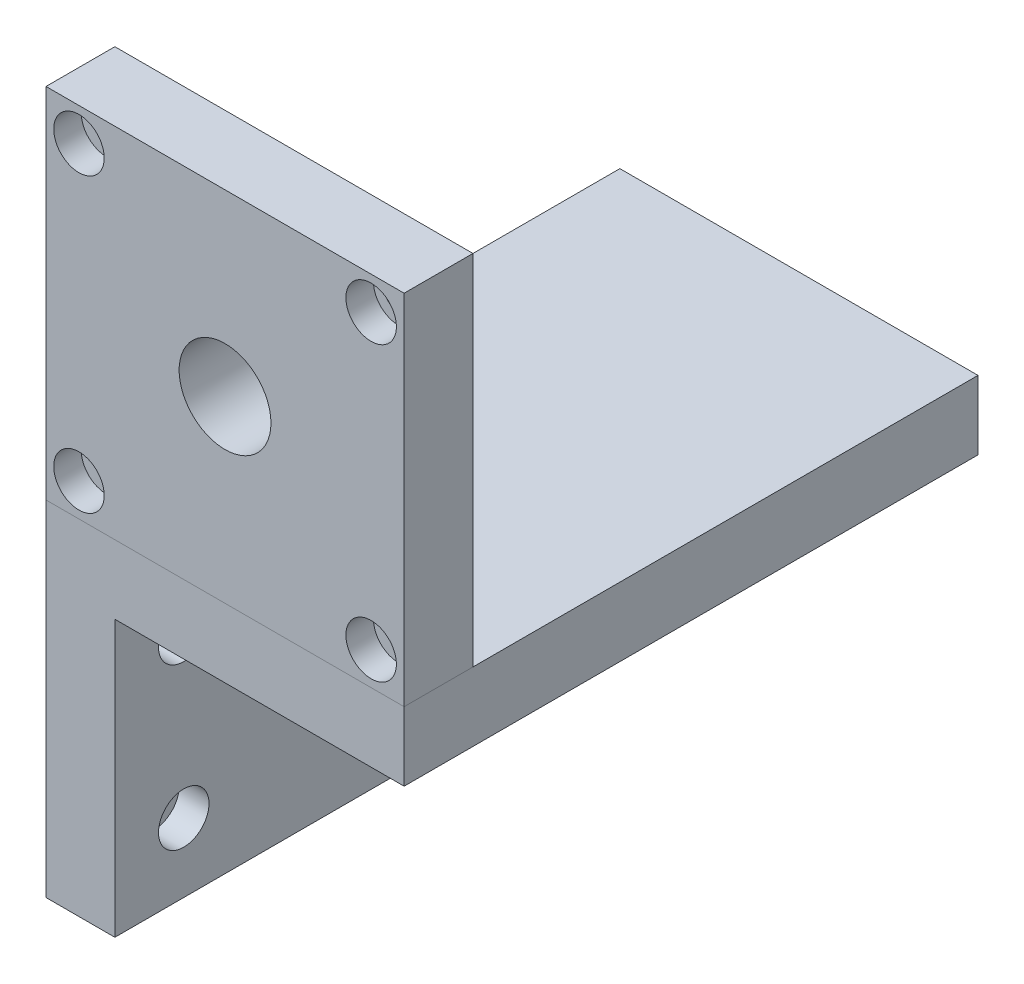
from build123d import *

# Parameters (mm, degrees)
SKETCH_1_W          = 78
SKETCH_1_H          = 78
EXTRUDE_1_DEPTH     = 15
SKETCH_2_W          = 78
SKETCH_2_H          = 125
EXTRUDE_2_DEPTH     = 15
SKETCH_3_W          = 15
SKETCH_3_H          = 125
EXTRUDE_3_DEPTH     = 60
SKETCH_4_R          = 3.083261121
SKETCH_4_R_2        = 2.75
CUT_EXTRUDE_1_DEPTH = 156.78189882
SKETCH_5_R          = 10
CUT_EXTRUDE_2_DEPTH = 60
SKETCH_6_R          = 5.5
CUT_EXTRUDE_3_DEPTH = 6
SKETCH_7_R          = 3.5
CUT_EXTRUDE_4_DEPTH = 149.838839017
SKETCH_8_R          = 5.5
CUT_EXTRUDE_5_DEPTH = 6.5


with BuildPart() as part:
    # 草图1 → 凸台-拉伸1 (new body)
    with BuildSketch(Plane.XY):
        with Locations((39, 39)):
            Rectangle(SKETCH_1_W, SKETCH_1_H)
    extrude(amount=EXTRUDE_1_DEPTH)

    # 草图4 → 切除-拉伸1 (cut, through all)
    with BuildSketch(Plane(origin=(0, 0, 0), x_dir=(-1, 0, 0), z_dir=(0, 0, -1))):
        with Locations((-70.819805153, 70.819805153)):
            Circle(SKETCH_4_R)
        with Locations((-70.819805153, 7.180194847)):
            Circle(SKETCH_4_R_2)
        with Locations((-7.180194847, 70.819805153)):
            Circle(SKETCH_4_R_2)
        with Locations((-7.180194847, 7.180194847)):
            Circle(SKETCH_4_R_2)
    extrude(amount=-CUT_EXTRUDE_1_DEPTH, mode=Mode.SUBTRACT)

    # 草图5 → 切除-拉伸2 (cut)
    with BuildSketch(Plane.XY.offset(15)):
        with Locations((39, 39)):
            Circle(SKETCH_5_R)
    extrude(amount=-CUT_EXTRUDE_2_DEPTH, mode=Mode.SUBTRACT)

    # 草图6 → 切除-拉伸3 (cut)
    with BuildSketch(Plane.XY.offset(15)):
        with Locations((7.180194847, 70.819805153)):
            Circle(SKETCH_6_R)
        with Locations((7.180194847, 7.180194847)):
            Circle(SKETCH_6_R)
        with Locations((70.819805153, 7.180194847)):
            Circle(SKETCH_6_R)
        with Locations((70.819805153, 70.819805153)):
            Circle(SKETCH_6_R)
    extrude(amount=-CUT_EXTRUDE_3_DEPTH, mode=Mode.SUBTRACT)


with BuildPart() as body_2:
    # 草图2 → 凸台-拉伸2 (new body)
    with BuildSketch(Plane.XZ):
        with Locations((39, -47.5)):
            Rectangle(SKETCH_2_W, SKETCH_2_H)
    extrude(amount=EXTRUDE_2_DEPTH)

    # 草图3 → 凸台-拉伸3 (add)
    with BuildSketch(Plane.XZ.offset(15)):
        with Locations((7.5, -47.5)):
            Rectangle(SKETCH_3_W, SKETCH_3_H)
    extrude(amount=EXTRUDE_3_DEPTH)

    # 草图7 → 切除-拉伸4 (cut, through all)
    with BuildSketch(Plane(origin=(15, 0, 0), x_dir=(0, 0, -1), z_dir=(1, 0, 0))):
        with Locations((0, -25)):
            Circle(SKETCH_7_R)
        with Locations((95, -25)):
            Circle(SKETCH_7_R)
        with Locations((0, -60)):
            Circle(SKETCH_7_R)
        with Locations((95, -60)):
            Circle(SKETCH_7_R)
    extrude(amount=-CUT_EXTRUDE_4_DEPTH, mode=Mode.SUBTRACT)

    # 草图8 → 切除-拉伸5 (cut)
    with BuildSketch(Plane(origin=(15, 0, 0), x_dir=(0, 0, -1), z_dir=(1, 0, 0))):
        with Locations((0, -25)):
            Circle(SKETCH_8_R)
        with Locations((0, -60)):
            Circle(SKETCH_8_R)
        with Locations((95, -60)):
            Circle(SKETCH_8_R)
        with Locations((95, -25)):
            Circle(SKETCH_8_R)
    extrude(amount=-CUT_EXTRUDE_5_DEPTH, mode=Mode.SUBTRACT)


solid = Compound([part.part, body_2.part])
